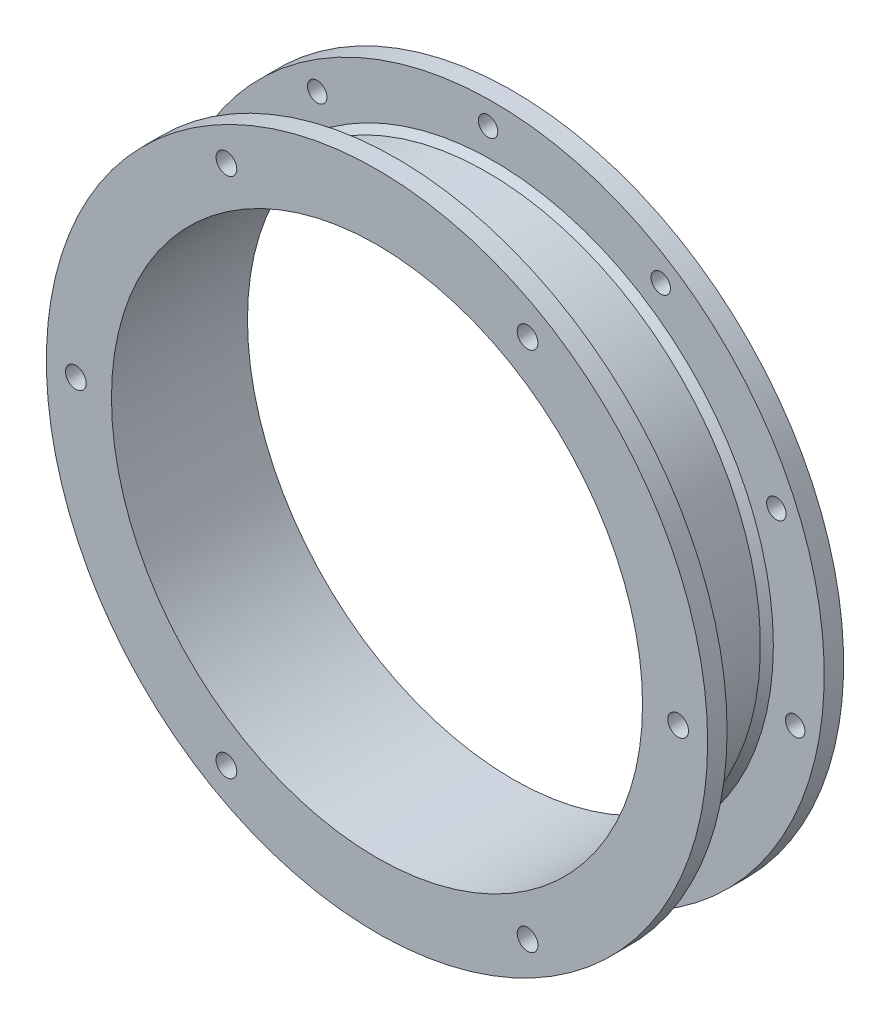
from build123d import *

# Parameters (mm, degrees)
SKETCH_1_R          = 42.2
SKETCH_1_R_2        = 41
EXTRUDE_1_DEPTH     = 21
SKETCH_2_R          = 51.055310859
SKETCH_2_R_2        = 42.2
EXTRUDE_2_DEPTH     = 3
SKETCH_3_R          = 1.5
CUT_EXTRUDE_1_DEPTH = 12
EXTRUDE1_START      = -3
SKETCH1_R           = 51.055310859
SKETCH1_R_2         = 42.2
SKETCH1_R_3         = 1.6
EXTRUDE1_DEPTH      = 3
CHAMFER1_SIZE       = 1


with BuildPart() as part:
    # 草图1 → 凸台-拉伸1 (new body)
    with BuildSketch(Plane.XY):
        with Locations((-1.800213466, -86)):
            Circle(SKETCH_1_R)
        with Locations((-1.800213466, -86)):
            Circle(SKETCH_1_R_2, mode=Mode.SUBTRACT)
    extrude(amount=EXTRUDE_1_DEPTH)

    # 草图2 → 凸台-拉伸2 (add)
    with BuildSketch(Plane(origin=(0, 0, 0), x_dir=(-1, 0, 0), z_dir=(0, 0, -1))):
        with Locations((1.800213466, -86)):
            Circle(SKETCH_2_R)
        with Locations((1.800213466, -86)):
            Circle(SKETCH_2_R_2, mode=Mode.SUBTRACT)
    extrude(amount=-EXTRUDE_2_DEPTH)

    # 草图3 → 切除-拉伸1 (cut)
    with BuildSketch(Plane.XY.offset(3)):
        with Locations((44.771512493, -95.028924631)):
            Circle(SKETCH_3_R)
        with Locations((-2.651398789, -38.568759005)):
            Circle(SKETCH_3_R)
        with Locations((41.858407753, -67.4427391)):
            Circle(SKETCH_3_R)
        with Locations((24.017335287, -46.20174231)):
            Circle(SKETCH_3_R)
        with Locations((-46.096553953, -69.021149678)):
            Circle(SKETCH_3_R)
        with Locations((-29.029091447, -47.153695895)):
            Circle(SKETCH_3_R)
    extrude(amount=-CUT_EXTRUDE_1_DEPTH, mode=Mode.SUBTRACT)

    # Sketch1 → Extrude1 (add)
    with BuildSketch(Plane.XY.offset(21).offset(EXTRUDE1_START)):
        with Locations(Location((-1.800213466, -86, 0), (0, 0, 180))):
            Circle(SKETCH1_R)
        with Locations(Location((-1.800213466, -86, 0), (0, 0, 180))):
            Circle(SKETCH1_R_2, mode=Mode.SUBTRACT)
        with Locations((-25.050213466, -45.729818724)):
            Circle(SKETCH1_R_3, mode=Mode.SUBTRACT)
        with Locations((21.449786534, -45.729818724)):
            Circle(SKETCH1_R_3, mode=Mode.SUBTRACT)
        with Locations((44.699786534, -86)):
            Circle(SKETCH1_R_3, mode=Mode.SUBTRACT)
        with Locations((21.449786534, -126.270181276)):
            Circle(SKETCH1_R_3, mode=Mode.SUBTRACT)
        with Locations((-25.050213466, -126.270181276)):
            Circle(SKETCH1_R_3, mode=Mode.SUBTRACT)
        with Locations((-48.300213466, -86)):
            Circle(SKETCH1_R_3, mode=Mode.SUBTRACT)
    extrude(amount=EXTRUDE1_DEPTH)

    # Chamfer1
    chamfer1_edges = [part.edges().sort_by_distance(p)[0] for p in [
        (-44.000213466, -86, 3),
        (-44.000213466, -86, 18),
    ]]
    chamfer(chamfer1_edges, length=CHAMFER1_SIZE)


solid = part.part
